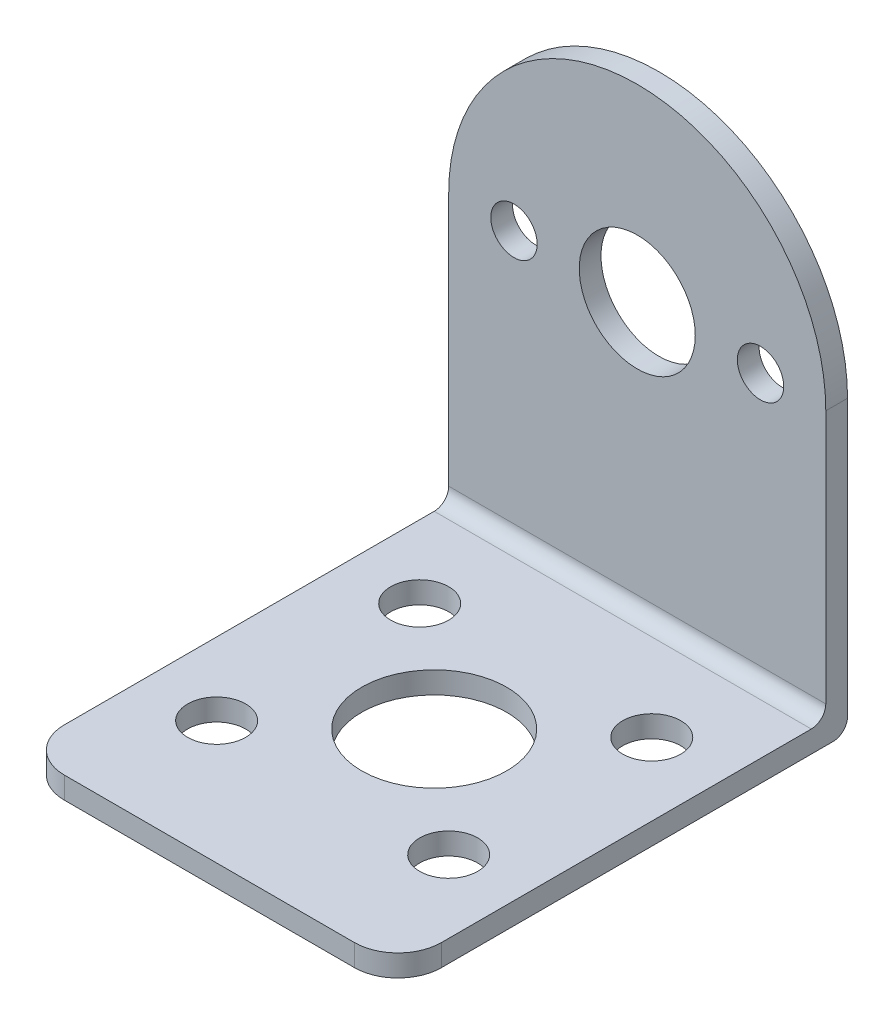
from build123d import *

# Parameters (mm, degrees)
SKETCH1_W           = 26
SKETCH1_H           = 31
SKETCH1_R           = 5
SKETCH1_R_2         = 2
BOSS_EXTRUDE1_DEPTH = 1.5
SKETCH2_W           = 26
SKETCH2_H           = 1.5
BOSS_EXTRUDE2_DEPTH = 31.5
SKETCH3_R           = 1.6
SKETCH3_R_2         = 4
CUT_EXTRUDE1_DEPTH  = 1.5
FILLET1_R           = 1
FILLET2_R           = 3


with BuildPart() as part:
    # Sketch1 → Boss-Extrude1 (new body)
    with BuildSketch(Plane(origin=(0, 0, 0), x_dir=(1, 0, 0), z_dir=(0, 1, 0))):
        Rectangle(SKETCH1_W, SKETCH1_H)
        with Locations(Location((0, 0, 0), (0, 0, 270))):
            Circle(SKETCH1_R, mode=Mode.SUBTRACT)
        with Locations(Location((-8, 7, 0), (0, 0, 270))):
            Circle(SKETCH1_R_2, mode=Mode.SUBTRACT)
        with Locations(Location((8, 7, 0), (0, 0, 270))):
            Circle(SKETCH1_R_2, mode=Mode.SUBTRACT)
        with Locations(Location((-8, -7, 0), (0, 0, 270))):
            Circle(SKETCH1_R_2, mode=Mode.SUBTRACT)
        with Locations(Location((8, -7, 0), (0, 0, 270))):
            Circle(SKETCH1_R_2, mode=Mode.SUBTRACT)
    extrude(amount=BOSS_EXTRUDE1_DEPTH)

    # Sketch2 → Boss-Extrude2 (add)
    with BuildSketch(Plane(origin=(0, 1.5, 0), x_dir=(1, 0, 0), z_dir=(0, 1, 0))):
        with Locations((0, 14.75)):
            Rectangle(SKETCH2_W, SKETCH2_H)
    extrude(amount=BOSS_EXTRUDE2_DEPTH)

    # Sketch3 → Cut-Extrude1 (cut)
    with BuildSketch(Plane.XY.offset(-14)):
        with BuildLine():
            Line((-13, 33), (-13, 20))
            ThreePointArc((-13, 20), (-9.192388155, 29.192388155), (0, 33))
            Line((0, 33), (-13, 33))
        make_face()
        with BuildLine():
            Line((13, 33), (0, 33))
            ThreePointArc((0, 33), (9.192388155, 29.192388155), (13, 20))
            Line((13, 20), (13, 33))
        make_face()
        with Locations((-8.5, 20)):
            Circle(SKETCH3_R)
        with Locations((0, 20)):
            Circle(SKETCH3_R_2)
        with Locations((8.5, 20)):
            Circle(SKETCH3_R)
    extrude(amount=-CUT_EXTRUDE1_DEPTH, mode=Mode.SUBTRACT)

    # Fillet1
    fillet1_edges = [part.edges().sort_by_distance(p)[0] for p in [
        (0, 1.5, -14),
        (0, 0, -15.5),
    ]]
    fillet(fillet1_edges, radius=FILLET1_R)

    # Fillet2
    fillet2_edges = [part.edges().sort_by_distance(p)[0] for p in [
        (13, 0.75, 15.5),
        (-13, 0.75, 15.5),
    ]]
    fillet(fillet2_edges, radius=FILLET2_R)


solid = part.part
